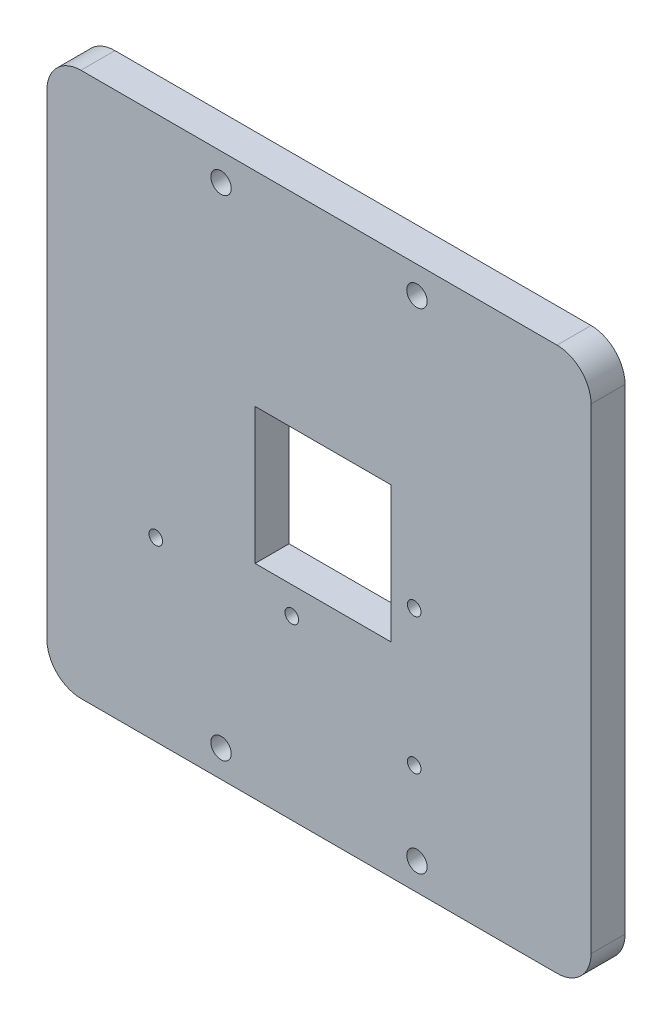
from build123d import *

# Parameters (mm, degrees)
ESQUISSE1_R             = 1.5
BOSS_EXTRU_1_DEPTH      = 5
ESQUISSE2_W             = 20
ESQUISSE2_H             = 20
ENL_V_MAT_EXTRU_1_DEPTH = 114.247516529
ESQUISSE3_R             = 1
ENL_V_MAT_EXTRU_2_DEPTH = 114.247516529


with BuildPart() as part:
    # Esquisse1 → Boss.-Extru.1 (new body)
    with BuildSketch(Plane.XY):
        with BuildLine():
            Line((40, 50), (40, 80))
            Line((40, 80), (5, 80))
            ThreePointArc((5, 80), (1.464466094, 78.535533906), (0, 75))
            Line((0, 75), (0, 5))
            ThreePointArc((0, 5), (1.464466094, 1.464466094), (5, 0))
            Line((5, 0), (40, 0))
            Line((40, 0), (40, 30))
            Line((40, 30), (40, 50))
        make_face()
        with Locations((25.6, 76)):
            Circle(ESQUISSE1_R, mode=Mode.SUBTRACT)
        with Locations((25.6, 4)):
            Circle(ESQUISSE1_R, mode=Mode.SUBTRACT)
    boss_extru_1 = extrude(amount=BOSS_EXTRU_1_DEPTH)

    # Symétrie1: Boss.-Extru.1 across plane
    add(boss_extru_1.mirror(Plane(origin=(40, 50, 5), x_dir=(0, 0, 1), z_dir=(-1, 0, 0))))

    # Esquisse2 → Enlèv. mat.-Extru.1 (cut, through all)
    with BuildSketch(Plane.XY.offset(5)):
        with Locations((40.6, 40)):
            Rectangle(ESQUISSE2_W, ESQUISSE2_H)
    extrude(amount=-ENL_V_MAT_EXTRU_1_DEPTH, mode=Mode.SUBTRACT)

    # Esquisse3 → Enlèv. mat.-Extru.2 (cut, through all)
    with BuildSketch(Plane.XY.offset(5)):
        with Locations((54, 36)):
            Circle(ESQUISSE3_R)
        with Locations((54, 16)):
            Circle(ESQUISSE3_R)
        with Locations((36, 26)):
            Circle(ESQUISSE3_R)
        with Locations((16, 26)):
            Circle(ESQUISSE3_R)
    extrude(amount=-ENL_V_MAT_EXTRU_2_DEPTH, mode=Mode.SUBTRACT)


solid = part.part
